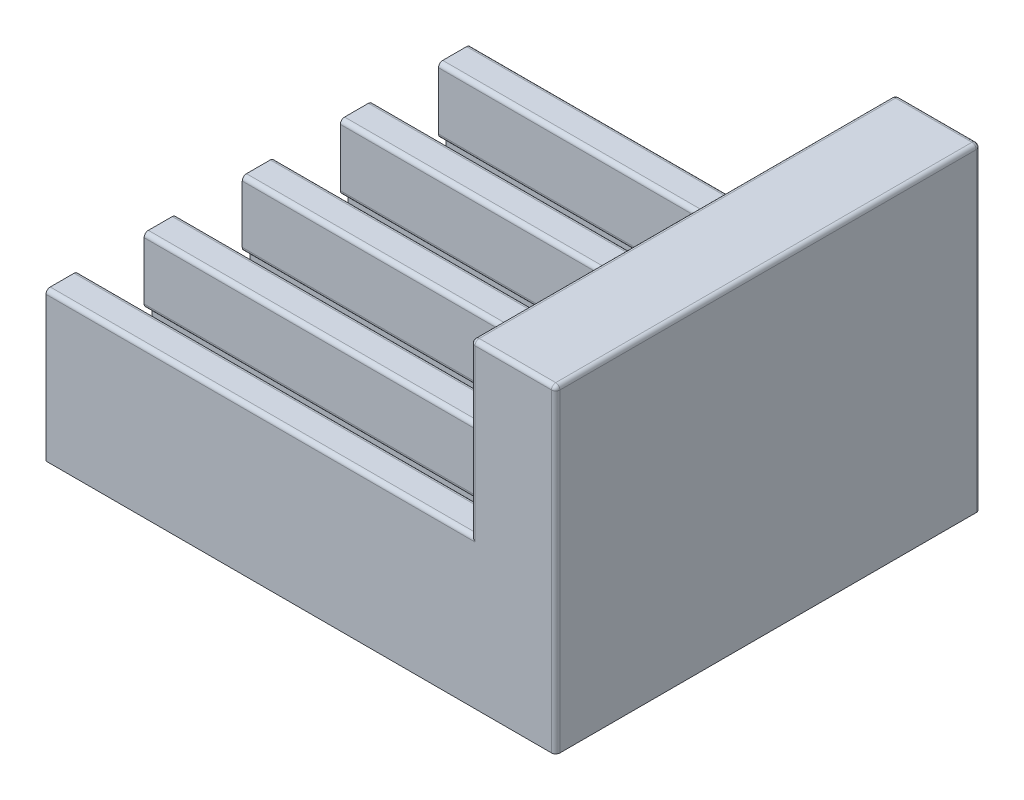
from build123d import *

# Parameters (mm, degrees)
SKETCH1_W           = 120
SKETCH1_H           = 100
BOSS_EXTRUDE1_DEPTH = 75
SKETCH2_W           = 100
SKETCH2_H           = 100
CUT_EXTRUDE1_DEPTH  = 40
SKETCH6_W           = 15.5
SKETCH6_H           = 15.5
CUT_EXTRUDE4_DEPTH  = 100
SKETCH8_W           = 19.1
SKETCH8_H           = 10
CUT_EXTRUDE5_DEPTH  = 100
SKETCH6_3_R         = 5.95
CUT_EXTRUDE6_DEPTH  = 111
FILLET1_R           = 1
CHAMFER1_SIZE       = 1
FILLET2_R           = 1
FILLET3_R           = 1


with BuildPart() as part:
    # Sketch1 → Boss-Extrude1 (new body)
    with BuildSketch(Plane(origin=(0, 0, 0), x_dir=(1, 0, 0), z_dir=(0, 1, 0))):
        with Locations((-3.53539823, -7.581858407)):
            Rectangle(SKETCH1_W, SKETCH1_H)
    extrude(amount=BOSS_EXTRUDE1_DEPTH)

    # Sketch2 → Cut-Extrude1 (cut)
    with BuildSketch(Plane(origin=(0, 75, 0), x_dir=(1, 0, 0), z_dir=(0, 1, 0))):
        with Locations((-13.53539823, -7.581858407)):
            Rectangle(SKETCH2_W, SKETCH2_H)
    extrude(amount=-CUT_EXTRUDE1_DEPTH, mode=Mode.SUBTRACT)

    # Sketch6 → Cut-Extrude4 (cut)
    with BuildSketch(Plane.ZY.offset(63.53539823)):
        with Locations((-27.068141593, 27.25)):
            Rectangle(SKETCH6_W, SKETCH6_H)
        with Locations((-3.968141593, 27.25)):
            Rectangle(SKETCH6_W, SKETCH6_H)
        with Locations((19.131858407, 27.25)):
            Rectangle(SKETCH6_W, SKETCH6_H)
        with Locations((42.231858407, 27.25)):
            Rectangle(SKETCH6_W, SKETCH6_H)
    extrude(amount=-CUT_EXTRUDE4_DEPTH, mode=Mode.SUBTRACT)

    # Sketch8 → Cut-Extrude5 (cut)
    with BuildSketch(Plane.ZY.offset(63.53539823)):
        with Locations((-27.068141593, 14.5)):
            Rectangle(SKETCH8_W, SKETCH8_H)
        with Locations((-3.968141593, 14.5)):
            Rectangle(SKETCH8_W, SKETCH8_H)
        with Locations((42.231858407, 14.5)):
            Rectangle(SKETCH8_W, SKETCH8_H)
        with Locations((19.131858407, 14.5)):
            Rectangle(SKETCH8_W, SKETCH8_H)
    extrude(amount=-CUT_EXTRUDE5_DEPTH, mode=Mode.SUBTRACT)

    # Sketch6<3> → Cut-Extrude6 (cut)
    with BuildSketch(Plane.ZY.offset(63.53539823)):
        with Locations((-27.068141593, 27.25)):
            Circle(SKETCH6_3_R)
        with Locations((-3.968141593, 27.25)):
            Circle(SKETCH6_3_R)
        with Locations((42.231858407, 27.25)):
            Circle(SKETCH6_3_R)
        with Locations((19.131858407, 27.25)):
            Circle(SKETCH6_3_R)
    extrude(amount=-CUT_EXTRUDE6_DEPTH, mode=Mode.SUBTRACT)

    # Fillet1
    fillet1_edges = [part.edges().sort_by_distance(p)[0] for p in [
        (-13.53539823, 35, -42.418141593),
        (-13.53539823, 35, 57.581858407),
        (36.46460177, 55, -42.418141593),
        (36.46460177, 55, 57.581858407),
        (46.46460177, 75, 57.581858407),
        (36.46460177, 75, 7.581858407),
        (46.46460177, 75, -42.418141593),
        (56.46460177, 75, 7.581858407),
        (56.46460177, 37.5, 57.581858407),
        (56.46460177, 37.5, -42.418141593),
    ]]
    fillet(fillet1_edges, radius=FILLET1_R)

    # Chamfer1
    chamfer1_edges = [part.edges().sort_by_distance(p)[0] for p in [
        (36.46460177, 27.25, 36.281858407),
        (36.46460177, 27.25, 13.181858407),
        (36.46460177, 27.25, -9.918141593),
        (36.46460177, 27.25, -33.018141593),
    ]]
    chamfer(chamfer1_edges, length=CHAMFER1_SIZE)

    # Fillet2
    fillet2_edges = [part.edges().sort_by_distance(p)[0] for p in [
        (47.46460177, 27.25, 36.281858407),
        (47.46460177, 27.25, 13.181858407),
        (47.46460177, 27.25, -9.918141593),
        (47.46460177, 27.25, -33.018141593),
    ]]
    fillet(fillet2_edges, radius=FILLET2_R)

    # Fillet3
    fillet3_edges = [part.edges().sort_by_distance(p)[0] for p in [
        (-13.53539823, 19.5, -19.318141593),
        (-13.53539823, 19.5, 3.781858407),
        (-13.53539823, 19.5, 26.881858407),
        (-13.53539823, 19.5, -34.818141593),
        (-13.53539823, 19.5, -11.718141593),
        (-13.53539823, 19.5, 11.381858407),
        (-13.53539823, 19.5, 34.481858407),
        (-13.53539823, 19.5, 49.981858407),
        (-13.53539823, 35, -34.818141593),
        (-13.53539823, 35, -19.318141593),
        (-13.53539823, 35, -11.718141593),
        (-13.53539823, 35, 3.781858407),
        (-13.53539823, 35, 26.881858407),
        (-13.53539823, 35, 11.381858407),
        (-13.53539823, 35, 34.481858407),
        (-13.53539823, 35, 49.981858407),
    ]]
    fillet(fillet3_edges, radius=FILLET3_R)


solid = part.part
